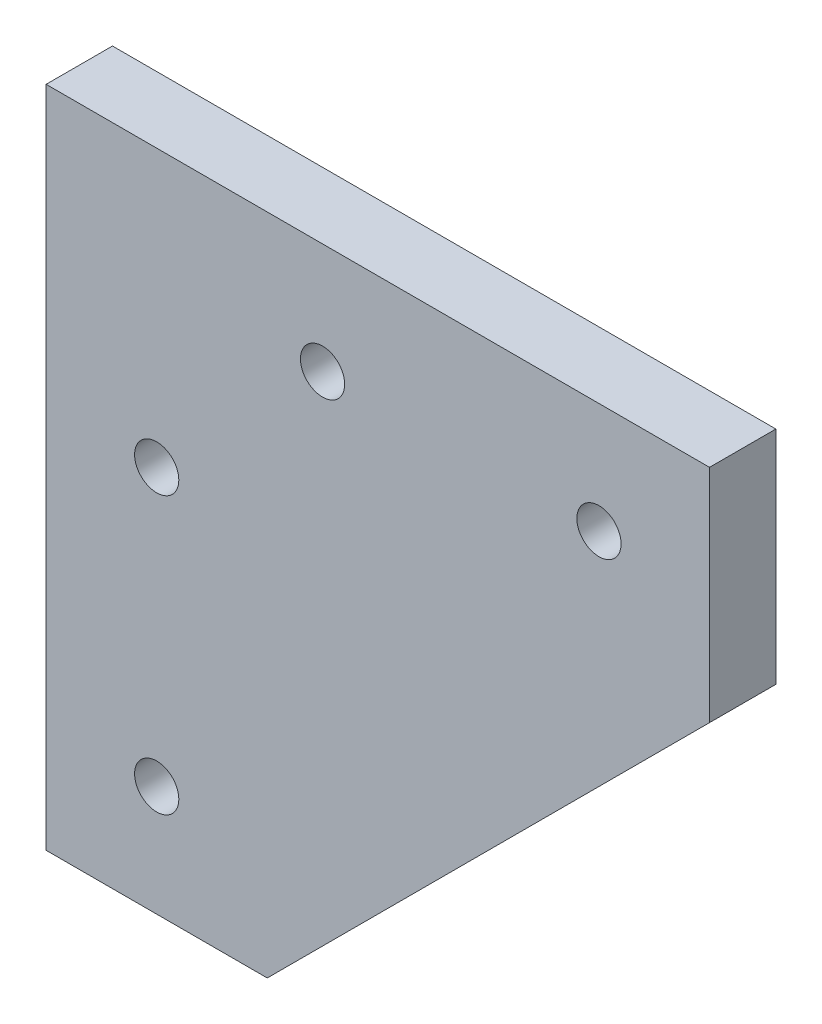
from build123d import *

# Parameters (mm, degrees)
SKETCH1_R           = 2
BOSS_EXTRUDE1_DEPTH = 6


with BuildPart() as part:
    # Sketch1 → Boss-Extrude1 (new body)
    with BuildSketch(Plane.XY):
        Polygon((20, -60), (60, -20), (60, 0), (0, 0), (0, -60), align=None)
        with Locations((50, -10)):
            Circle(SKETCH1_R, mode=Mode.SUBTRACT)
        with Locations((25, -10)):
            Circle(SKETCH1_R, mode=Mode.SUBTRACT)
        with Locations((10, -50)):
            Circle(SKETCH1_R, mode=Mode.SUBTRACT)
        with Locations((10, -25)):
            Circle(SKETCH1_R, mode=Mode.SUBTRACT)
    extrude(amount=BOSS_EXTRUDE1_DEPTH)


solid = part.part
